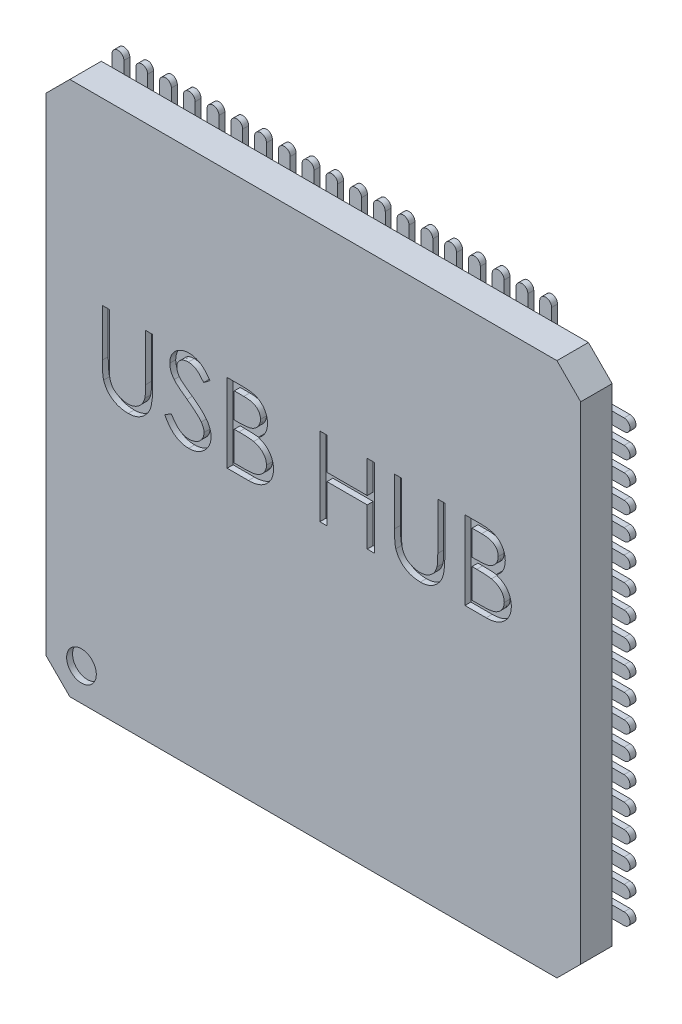
from build123d import *

# Parameters (mm, degrees)
ESQUISSE1_W                         = 9
ESQUISSE1_H                         = 9
BOSS_EXTRU_1_DEPTH                  = 0.53
DIAM_TRE_DU_PER_AGE_0_5_0_5_1_D     = 0.5
DIAM_TRE_DU_PER_AGE_0_5_0_5_1_DEPTH = 0.1
CHANFREIN1_SIZE                     = 0.4
ENL_V_MAT_EXTRU_1_DEPTH             = 0.1
ESQUISSE4_W                         = 6.1
ESQUISSE4_H                         = 6.1
BOSS_EXTRU_2_DEPTH                  = 0.1


with BuildPart() as part:
    # Esquisse1 → Boss.-Extru.1 (new body)
    with BuildSketch(Plane(origin=(0, 0, 6.629712515), x_dir=(-1, 0, 0), z_dir=(0, 0, -1))):
        with Locations((-7.398512621, 3.060383304)):
            Rectangle(ESQUISSE1_W, ESQUISSE1_H)
    extrude(amount=-BOSS_EXTRU_1_DEPTH)

    # Diamètre du perçage Ø0.5 (0.5)1
    with Locations(Plane.XY.offset(7.159712515)):
        with Locations((3.49470675, -0.891699119)):
            Hole(DIAM_TRE_DU_PER_AGE_0_5_0_5_1_D / 2, depth=DIAM_TRE_DU_PER_AGE_0_5_0_5_1_DEPTH)

    # Chanfrein1
    chanfrein1_edges = [part.edges().sort_by_distance(p)[0] for p in [
        (2.898512621, 7.560383304, 6.894712515),
        (2.898512621, -1.439616696, 6.894712515),
        (11.898512621, -1.439616696, 6.894712515),
        (11.898512621, 7.560383304, 6.894712515),
    ]]
    chamfer(chanfrein1_edges, length=CHANFREIN1_SIZE)

    # Esquisse5 → Enlèv. mat.-Extru.1 (cut)
    # profile 1 of 6: a face of its own
    with BuildSketch(Plane.XY.offset(7.159712515)):
        with BuildLine():
            Line((3.84456863, 4.539442904), (3.96329192, 4.539442904))
            Line((3.96329192, 4.539442904), (3.96329192, 3.746805935))
            add(Edge.make_bspline(
                [(3.96329192, 3.746805935), (3.963274252, 3.735587324), (3.963240724, 3.714298075), (3.96346468, 3.683996367), (3.964091882, 3.657057074), (3.964487305, 3.633376356), (3.965366982, 3.613062877), (3.966084399, 3.596006584), (3.967006871, 3.58228824), (3.968115519, 3.574282354), (3.968592067, 3.570841058)],
                knots=[0, 0, 0, 0, 1.528628734, 2.90083645, 4.128790002, 5.200304208, 6.127813768, 6.898992206, 7.526736466, 8, 8, 8, 8], degree=3))
            add(Edge.make_bspline(
                [(3.968592067, 3.570841058), (3.970549023, 3.558425764), (3.974352668, 3.534294732), (3.984046388, 3.499933566), (3.997584551, 3.468965426), (4.013627011, 3.440423955), (4.034768206, 3.415103572), (4.060093947, 3.391778037), (4.090777211, 3.37137798), (4.124893571, 3.352724548), (4.161665074, 3.337732091), (4.199240166, 3.326395314), (4.23705403, 3.319486325), (4.262369426, 3.318686323), (4.274940558, 3.318289058)],
                knots=[0, 0, 0, 0, 1.035780045, 2.013197591, 2.933192213, 3.817615948, 4.702609284, 5.640816605, 6.646850145, 7.73207398, 8.84249596, 9.914020372, 10.964143139, 12, 12, 12, 12], degree=3))
            add(Edge.make_bspline(
                [(4.274940558, 3.318289058), (4.285733192, 3.318694948), (4.307256125, 3.319504383), (4.339235341, 3.324516889), (4.37038062, 3.333550733), (4.400845758, 3.345207428), (4.429402232, 3.360609047), (4.456065973, 3.378400704), (4.479864841, 3.3992691), (4.501582596, 3.422363576), (4.520494611, 3.448421179), (4.53688787, 3.476874523), (4.550315825, 3.508151805), (4.55694686, 3.530132792), (4.560353469, 3.541425243)],
                knots=[0, 0, 0, 0, 0.994687771, 1.983630487, 2.973142513, 3.978332533, 4.983357753, 5.956394766, 6.925816176, 7.893390482, 8.871859704, 9.88551698, 10.913711441, 12, 12, 12, 12], degree=3))
            add(Edge.make_bspline(
                [(4.560353469, 3.541425243), (4.561487445, 3.54609271), (4.5640144, 3.556493708), (4.566375634, 3.574077648), (4.568834946, 3.59482452), (4.570541346, 3.61888339), (4.572204903, 3.646173639), (4.573200141, 3.676837433), (4.573660151, 3.710763427), (4.573797235, 3.734438782), (4.573868844, 3.746805935)],
                knots=[0, 0, 0, 0, 0.558680831, 1.244966039, 2.062412453, 2.990489873, 4.051219941, 5.244515665, 6.560634259, 8, 8, 8, 8], degree=3))
            Line((4.573868844, 3.746805935), (4.573868844, 4.539442904))
            Line((4.573868844, 4.539442904), (4.692592134, 4.539442904))
            Line((4.692592134, 4.539442904), (4.692592134, 3.740445759))
            add(Edge.make_bspline(
                [(4.692592134, 3.740445759), (4.692496083, 3.726045479), (4.692308632, 3.697942457), (4.690683117, 3.656761437), (4.688091334, 3.617696471), (4.684429468, 3.580742307), (4.679577386, 3.546031181), (4.674181693, 3.513258843), (4.667310262, 3.48266054), (4.659284542, 3.453997691), (4.650109719, 3.426713286), (4.638225713, 3.400818661), (4.624836096, 3.375526611), (4.608955557, 3.351219677), (4.591110779, 3.327790236), (4.570907316, 3.305380377), (4.549013362, 3.283631987), (4.525064957, 3.263102942), (4.499456872, 3.244276448), (4.472265281, 3.227721933), (4.443699061, 3.213727887), (4.413832469, 3.202208713), (4.382652758, 3.19354754), (4.350159143, 3.187093538), (4.316277662, 3.183426301), (4.293234474, 3.182881285), (4.281565742, 3.182605298)],
                knots=[0, 0, 0, 0, 1.316592851, 2.569410997, 3.76748051, 4.895814652, 5.963796859, 6.97159953, 7.931736103, 8.829262218, 9.692595152, 10.560224239, 11.431080259, 12.30701507, 13.211635791, 14.121146779, 15.063487852, 16.031507147, 17.00238618, 17.966455255, 18.938106653, 19.907068911, 20.888905087, 21.893141452, 22.933117798, 24, 24, 24, 24], degree=3))
            add(Edge.make_bspline(
                [(4.281565742, 3.182605298), (4.268839623, 3.18290192), (4.243871023, 3.183483893), (4.207079551, 3.186818682), (4.171809006, 3.193100039), (4.137686874, 3.201097994), (4.10517771, 3.212128752), (4.073845962, 3.225017032), (4.044228246, 3.240845639), (4.015844075, 3.258456832), (3.98945198, 3.278272097), (3.965224688, 3.299869722), (3.943122201, 3.322903734), (3.923517069, 3.347623515), (3.906084472, 3.373836809), (3.891067398, 3.401617772), (3.878173404, 3.430955647), (3.87151854, 3.451348672), (3.868154284, 3.461658032)],
                knots=[0, 0, 0, 0, 1.13879206, 2.234305948, 3.301075583, 4.341971843, 5.366689343, 6.369221514, 7.369726634, 8.367512178, 9.355451585, 10.318319045, 11.268648973, 12.207971039, 13.137398894, 14.081662264, 15.030215811, 16, 16, 16, 16], degree=3))
            add(Edge.make_bspline(
                [(3.868154284, 3.461658032), (3.866197441, 3.468700701), (3.861953006, 3.483976408), (3.85740773, 3.509257909), (3.853586738, 3.538367714), (3.849993863, 3.571307817), (3.84787381, 3.608103748), (3.846015136, 3.648739559), (3.844555536, 3.693264384), (3.844564143, 3.724279037), (3.84456863, 3.740445759)],
                knots=[0, 0, 0, 0, 0.625038921, 1.35572334, 2.194682327, 3.136881307, 4.189498639, 5.346923369, 6.617055217, 8, 8, 8, 8], degree=3))
            Line((3.84456863, 3.740445759), (3.84456863, 4.539442904))
        make_face()
    # profile 2 of 6: a face of its own
    with BuildSketch(Plane.XY.offset(7.159712515)):
        with BuildLine():
            Line((4.896117775, 3.471728311), (5.007950875, 3.538775169))
            add(Edge.make_bspline(
                [(5.007950875, 3.538775169), (5.018352113, 3.521363929), (5.038280485, 3.488004663), (5.071524004, 3.442927964), (5.105970075, 3.404615482), (5.141873781, 3.373290097), (5.17901597, 3.348627572), (5.21763911, 3.331164228), (5.257613044, 3.320272475), (5.284817435, 3.318949526), (5.298398925, 3.318289058)],
                knots=[0, 0, 0, 0, 1.272034388, 2.437168799, 3.508375237, 4.49857839, 5.41946034, 6.295179144, 7.148887113, 8, 8, 8, 8], degree=3))
            add(Edge.make_bspline(
                [(5.298398925, 3.318289058), (5.309997828, 3.318612104), (5.332992679, 3.319252543), (5.366845075, 3.325406299), (5.399722125, 3.334860288), (5.430946223, 3.348399747), (5.46008653, 3.364780663), (5.485640251, 3.384566272), (5.50773149, 3.406718022), (5.525802197, 3.431431109), (5.539666377, 3.458009317), (5.550322308, 3.485290108), (5.556235773, 3.513702037), (5.55712657, 3.532831587), (5.557576108, 3.542485272)],
                knots=[0, 0, 0, 0, 1.095163259, 2.171163733, 3.241058638, 4.321873601, 5.38011039, 6.391990106, 7.366004449, 8.327778327, 9.272591725, 10.192022065, 11.087607919, 12, 12, 12, 12], degree=3))
            add(Edge.make_bspline(
                [(5.557576108, 3.542485272), (5.557018854, 3.55349982), (5.555886037, 3.575890785), (5.546311341, 3.608925773), (5.531249275, 3.641617905), (5.517353871, 3.661840109), (5.510139794, 3.672338871)],
                knots=[0, 0, 0, 0, 0.938893495, 1.908633276, 2.914225137, 4, 4, 4, 4], degree=3))
            add(Edge.make_bspline(
                [(5.510139794, 3.672338871), (5.504216675, 3.679916093), (5.491781827, 3.695823523), (5.470404434, 3.719501931), (5.445319623, 3.743926154), (5.417385839, 3.770028834), (5.385585534, 3.796595947), (5.350914718, 3.824894374), (5.3124882, 3.853847946), (5.285538688, 3.873265553), (5.271633183, 3.883284718)],
                knots=[0, 0, 0, 0, 0.722233717, 1.516239348, 2.393582979, 3.351407094, 4.387010283, 5.505090956, 6.712668013, 8, 8, 8, 8], degree=3))
            add(Edge.make_bspline(
                [(5.271633183, 3.883284718), (5.257714589, 3.8931985), (5.231103298, 3.912152895), (5.193888298, 3.940283503), (5.160609587, 3.966002465), (5.131415078, 3.989551898), (5.106317611, 4.010934996), (5.085119417, 4.029946419), (5.068360498, 4.047100325), (5.059041276, 4.058228451), (5.054857175, 4.063224705)],
                knots=[0, 0, 0, 0, 1.452282411, 2.77665338, 3.964542531, 5.026858415, 5.96415736, 6.766646006, 7.446254459, 8, 8, 8, 8], degree=3))
            add(Edge.make_bspline(
                [(5.054857175, 4.063224705), (5.049008921, 4.071011407), (5.037507545, 4.086325), (5.022325752, 4.110260289), (5.009421961, 4.13476194), (4.999306437, 4.159895793), (4.990788282, 4.185308995), (4.985058946, 4.211333127), (4.981471423, 4.237851414), (4.981104036, 4.255696993), (4.980920126, 4.264630288)],
                knots=[0, 0, 0, 0, 1.068054152, 2.10047183, 3.106115577, 4.101338837, 5.06977816, 6.043150881, 7.020423561, 8, 8, 8, 8], degree=3))
            add(Edge.make_bspline(
                [(4.980920126, 4.264630288), (4.981413463, 4.278626661), (4.982389595, 4.306320244), (4.99064479, 4.34677535), (5.003674723, 4.385399383), (5.021929041, 4.421809955), (5.045460838, 4.455059001), (5.072692501, 4.48552898), (5.1051272, 4.511143891), (5.140714649, 4.533524639), (5.179667504, 4.551042295), (5.220485495, 4.564256713), (5.263233495, 4.571744141), (5.292187656, 4.572818639), (5.30687916, 4.573363845)],
                knots=[0, 0, 0, 0, 1.005424448, 1.989358655, 2.955360095, 3.929531133, 4.905563448, 5.876582895, 6.856512386, 7.866279853, 8.892233794, 9.918561126, 10.94386622, 12, 12, 12, 12], degree=3))
            add(Edge.make_bspline(
                [(5.30687916, 4.573363845), (5.322468448, 4.572826154), (5.353470566, 4.571756859), (5.399073097, 4.562459578), (5.442979082, 4.547075693), (5.478298411, 4.52961748), (5.505940854, 4.512180903), (5.527021619, 4.49629841), (5.54838387, 4.478013771), (5.57019992, 4.457278282), (5.59210011, 4.433901683), (5.614409569, 4.408044071), (5.637180469, 4.379863468), (5.651829261, 4.359745874), (5.659338929, 4.349432638)],
                knots=[0, 0, 0, 0, 1.286793592, 2.559021753, 3.825965368, 5.121522368, 5.803751409, 6.523245864, 7.299691795, 8.125521123, 9.008227632, 9.944561021, 10.946284179, 12, 12, 12, 12], degree=3))
            Line((5.659338929, 4.349432638), (5.552010954, 4.268075383))
            add(Edge.make_bspline(
                [(5.552010954, 4.268075383), (5.5455302, 4.276424382), (5.533049783, 4.292502602), (5.51410203, 4.315019141), (5.496243166, 4.335587275), (5.478648223, 4.353452368), (5.462246464, 4.369592758), (5.446327225, 4.383411475), (5.431119598, 4.395043917), (5.411949813, 4.407458001), (5.387866033, 4.419763584), (5.357633782, 4.43017648), (5.326040161, 4.436433899), (5.304522115, 4.437261247), (5.293628793, 4.437680084)],
                knots=[0, 0, 0, 0, 1.181633172, 2.275549214, 3.290209073, 4.226197932, 5.078386478, 5.862611352, 6.581680152, 7.217281963, 8.414376989, 9.595101626, 10.782541182, 12, 12, 12, 12], degree=3))
            add(Edge.make_bspline(
                [(5.293628793, 4.437680084), (5.279962488, 4.43722209), (5.253608307, 4.436338892), (5.216192355, 4.426692946), (5.182516972, 4.411505159), (5.153581925, 4.390219438), (5.129490866, 4.365000492), (5.1120641, 4.335979912), (5.101575199, 4.303934183), (5.100295265, 4.281580045), (5.099643416, 4.270195442)],
                knots=[0, 0, 0, 0, 1.14458467, 2.207223713, 3.21896685, 4.227309161, 5.202851033, 6.127160689, 7.046193047, 8, 8, 8, 8], degree=3))
            add(Edge.make_bspline(
                [(5.099643416, 4.270195442), (5.099792009, 4.263107829), (5.100089437, 4.248921015), (5.104237649, 4.227961698), (5.10956686, 4.207055328), (5.118011842, 4.1862959), (5.129670633, 4.165320353), (5.144980625, 4.143767494), (5.164262442, 4.121447354), (5.179032622, 4.106930281), (5.186830833, 4.099265704)],
                knots=[0, 0, 0, 0, 0.858281714, 1.717966888, 2.583508476, 3.4729293, 4.427298488, 5.488583878, 6.674047936, 8, 8, 8, 8], degree=3))
            add(Edge.make_bspline(
                [(5.186830833, 4.099265704), (5.189726649, 4.096681471), (5.196606446, 4.090541925), (5.209183953, 4.080490676), (5.225793285, 4.068092009), (5.246000724, 4.05275097), (5.270178864, 4.034955298), (5.298330363, 4.014932534), (5.330141418, 3.992032673), (5.352714881, 3.976022532), (5.364650761, 3.967557054)],
                knots=[0, 0, 0, 0, 0.420754252, 0.999615792, 1.744751191, 2.668019286, 3.750313428, 4.999500688, 6.413464383, 8, 8, 8, 8], degree=3))
            add(Edge.make_bspline(
                [(5.364650761, 3.967557054), (5.379008532, 3.957109278), (5.406810365, 3.936878608), (5.446368439, 3.906483396), (5.482236039, 3.876756412), (5.514539095, 3.847887495), (5.543596736, 3.820095626), (5.569086589, 3.793046448), (5.591268378, 3.766933747), (5.615148619, 3.733455422), (5.639549937, 3.692338762), (5.660505507, 3.641962761), (5.67371893, 3.591390938), (5.675446854, 3.557400734), (5.676299399, 3.540630221)],
                knots=[0, 0, 0, 0, 1.163667725, 2.253281268, 3.268753668, 4.215851969, 5.092017293, 5.902905408, 6.650798638, 7.335211899, 8.59617414, 9.77448103, 10.901945474, 12, 12, 12, 12], degree=3))
            add(Edge.make_bspline(
                [(5.676299399, 3.540630221), (5.676051016, 3.528769946), (5.675559075, 3.505279715), (5.669904206, 3.470787468), (5.661619094, 3.43728711), (5.649131806, 3.405192731), (5.633890612, 3.373917181), (5.614550989, 3.344280861), (5.592134096, 3.315627848), (5.566418953, 3.288722183), (5.538280174, 3.264022876), (5.508539611, 3.242051475), (5.477148586, 3.223731603), (5.444277388, 3.208782326), (5.409918469, 3.197090193), (5.374083385, 3.188618662), (5.336713063, 3.183419331), (5.311312881, 3.182879671), (5.298398925, 3.182605298)],
                knots=[0, 0, 0, 0, 0.983748083, 1.948392443, 2.894712957, 3.844097841, 4.80183111, 5.778335162, 6.776009319, 7.81870978, 8.863265674, 9.881300176, 10.883814829, 11.87499822, 12.874611388, 13.892143829, 14.928324115, 16, 16, 16, 16], degree=3))
            add(Edge.make_bspline(
                [(5.298398925, 3.182605298), (5.288406995, 3.182798512), (5.268548972, 3.183182508), (5.239176638, 3.186577218), (5.210397687, 3.1913802), (5.182573241, 3.199005519), (5.155344814, 3.208257233), (5.12883083, 3.219648805), (5.103018437, 3.233300247), (5.077762982, 3.248908784), (5.053128696, 3.267073467), (5.029346635, 3.288230116), (5.005636496, 3.311795232), (4.982698105, 3.338408749), (4.960067482, 3.367640703), (4.938190822, 3.39976459), (4.916615292, 3.434605435), (4.903077897, 3.459122893), (4.896117775, 3.471728311)],
                knots=[0, 0, 0, 0, 0.915332311, 1.819136955, 2.706846663, 3.586547465, 4.459518054, 5.340707479, 6.227863349, 7.133153174, 8.059268498, 9.028702269, 10.047606654, 11.120612155, 12.245963614, 13.433783089, 14.680604001, 16, 16, 16, 16], degree=3))
        make_face()
    # profile 3 of 6: a face of its own
    with BuildSketch(Plane.XY.offset(7.159712515)):
        with BuildLine():
            Line((5.94766692, 4.539442904), (6.205784075, 4.539442904))
            add(Edge.make_bspline(
                [(6.205784075, 4.539442904), (6.218419243, 4.539376475), (6.242909345, 4.539247718), (6.278522051, 4.53725082), (6.311878, 4.534528005), (6.342986866, 4.530207702), (6.371834275, 4.524994738), (6.398507162, 4.51868185), (6.422920709, 4.511112266), (6.452067487, 4.49907513), (6.485299404, 4.481188099), (6.521282129, 4.454756767), (6.552050994, 4.422427532), (6.57857975, 4.385959386), (6.599671245, 4.345842591), (6.614929878, 4.303033314), (6.624590147, 4.258083727), (6.625583632, 4.22722455), (6.626085724, 4.211628819)],
                knots=[0, 0, 0, 0, 1.001505555, 1.941167018, 2.826882275, 3.653841531, 4.429895133, 5.150066043, 5.825578002, 6.45369114, 7.647487171, 8.808567382, 9.977351308, 11.170798116, 12.373658725, 13.556498008, 14.765093433, 16, 16, 16, 16], degree=3))
            add(Edge.make_bspline(
                [(6.626085724, 4.211628819), (6.625672513, 4.197019073), (6.624860516, 4.168309545), (6.617095842, 4.126318616), (6.604939875, 4.086347174), (6.588042355, 4.048541093), (6.566081184, 4.013754579), (6.540054379, 3.981707011), (6.508653326, 3.953755272), (6.485126863, 3.938128639), (6.473176486, 3.930191018)],
                knots=[0, 0, 0, 0, 1.044552857, 2.05264487, 3.044412934, 4.028983338, 5.005914585, 5.980388656, 6.974128949, 8, 8, 8, 8], degree=3))
            add(Edge.make_bspline(
                [(6.473176486, 3.930191018), (6.488204981, 3.924421212), (6.516958214, 3.913382143), (6.556527035, 3.893865168), (6.590618538, 3.872637227), (6.619494841, 3.849455248), (6.644190919, 3.824467691), (6.665755572, 3.797308169), (6.684155972, 3.767622389), (6.699922464, 3.735719862), (6.712225119, 3.701926346), (6.721438631, 3.66655882), (6.726717994, 3.629744107), (6.727469275, 3.604689812), (6.727848544, 3.592041646)],
                knots=[0, 0, 0, 0, 1.27268992, 2.434971085, 3.483601985, 4.442670788, 5.356604649, 6.2567628, 7.179492994, 8.113709626, 9.066344395, 10.018646069, 10.999752585, 12, 12, 12, 12], degree=3))
            add(Edge.make_bspline(
                [(6.727848544, 3.592041646), (6.72747932, 3.579127382), (6.72675286, 3.553718205), (6.721393168, 3.516391116), (6.712318298, 3.480719633), (6.699818192, 3.446473031), (6.683503865, 3.413717563), (6.663649545, 3.382416121), (6.639976305, 3.352883205), (6.613494209, 3.324790645), (6.583535005, 3.299531332), (6.551212085, 3.277035812), (6.516118387, 3.258535366), (6.478830282, 3.242994489), (6.438929484, 3.231123316), (6.396595165, 3.222818206), (6.351863837, 3.217222254), (6.321168485, 3.21676218), (6.305426836, 3.216526238)],
                knots=[0, 0, 0, 0, 0.978564426, 1.925352924, 2.850884081, 3.763762016, 4.682927383, 5.618979971, 6.567305752, 7.547517671, 8.540179244, 9.531824382, 10.526200242, 11.540722885, 12.589160233, 13.674978461, 14.80764778, 16, 16, 16, 16], degree=3))
            Line((6.305426836, 3.216526238), (5.94766692, 3.216526238))
            Line((5.94766692, 3.216526238), (5.94766692, 4.539442904))
        make_face()
        with BuildLine():
            Line((6.066390211, 4.403759144), (6.066390211, 3.979747392))
            Line((6.066390211, 3.979747392), (6.146157422, 3.979747392))
            add(Edge.make_bspline(
                [(6.146157422, 3.979747392), (6.157817532, 3.979898553), (6.180347241, 3.980190628), (6.212974107, 3.981027284), (6.243259456, 3.983369997), (6.271151012, 3.985712037), (6.296604852, 3.989519991), (6.319564586, 3.994052728), (6.340390543, 3.998846564), (6.364406979, 4.006999317), (6.391648837, 4.019048319), (6.420689921, 4.037747495), (6.446291938, 4.060019497), (6.467911113, 4.085718462), (6.485604734, 4.114016098), (6.497894145, 4.144460901), (6.506227493, 4.176294106), (6.506980245, 4.198148029), (6.507362433, 4.209243752)],
                knots=[0, 0, 0, 0, 1.156816544, 2.235205308, 3.236616184, 4.169592532, 5.011045266, 5.787822928, 6.49130361, 7.128639758, 8.301311294, 9.436451833, 10.541879658, 11.654887649, 12.756523258, 13.837046038, 14.901820046, 16, 16, 16, 16], degree=3))
            add(Edge.make_bspline(
                [(6.507362433, 4.209243752), (6.50716355, 4.216586232), (6.506773418, 4.230989306), (6.503578271, 4.251985639), (6.49814767, 4.271732534), (6.491172386, 4.290500605), (6.481424876, 4.307703001), (6.46994821, 4.323934507), (6.456081892, 4.338642361), (6.440298622, 4.352389165), (6.422152506, 4.364576829), (6.401654369, 4.375251165), (6.378526884, 4.383846637), (6.353159822, 4.391374469), (6.325162715, 4.396661711), (6.294858643, 4.401066414), (6.261999389, 4.403308849), (6.239265972, 4.403605698), (6.227514677, 4.403759144)],
                knots=[0, 0, 0, 0, 0.91205012, 1.789085906, 2.630437955, 3.453916878, 4.269457761, 5.079663411, 5.91843418, 6.774407191, 7.675494373, 8.627863946, 9.638891023, 10.736472738, 11.911756761, 13.175263542, 14.539845004, 16, 16, 16, 16], degree=3))
            Line((6.227514677, 4.403759144), (6.066390211, 4.403759144))
        make_face(mode=Mode.SUBTRACT)
        with BuildLine():
            Line((6.066390211, 3.844063631), (6.066390211, 3.352209998))
            Line((6.066390211, 3.352209998), (6.235464897, 3.352209998))
            add(Edge.make_bspline(
                [(6.235464897, 3.352209998), (6.247567289, 3.352355046), (6.270893053, 3.352634606), (6.304571197, 3.35354725), (6.335785644, 3.355623199), (6.364393957, 3.358891124), (6.390705051, 3.362435955), (6.41440329, 3.367202719), (6.435680776, 3.372664082), (6.460352911, 3.381105867), (6.488135487, 3.394220307), (6.518075304, 3.413993839), (6.544694738, 3.437550566), (6.567299702, 3.464814334), (6.585825445, 3.494459508), (6.599302358, 3.525886471), (6.607614378, 3.558575941), (6.608620615, 3.580863954), (6.609125254, 3.592041646)],
                knots=[0, 0, 0, 0, 1.160039823, 2.235823828, 3.228722157, 4.157150951, 4.99529583, 5.772374946, 6.472645482, 7.099169577, 8.269452708, 9.405989375, 10.527446681, 11.663510218, 12.788923519, 13.866172445, 14.929861265, 16, 16, 16, 16], degree=3))
            add(Edge.make_bspline(
                [(6.609125254, 3.592041646), (6.609020893, 3.599031688), (6.608813855, 3.612899023), (6.605691539, 3.633277919), (6.601150582, 3.653018056), (6.59528007, 3.672173035), (6.58673045, 3.690396543), (6.576749405, 3.708048999), (6.565046732, 3.725153736), (6.546811586, 3.746778606), (6.520288246, 3.771693667), (6.482601459, 3.796087307), (6.43974943, 3.815760139), (6.408669395, 3.824113214), (6.392614253, 3.828428198)],
                knots=[0, 0, 0, 0, 0.723448775, 1.435228256, 2.130040452, 2.821711965, 3.505591119, 4.210454504, 4.921174351, 5.648778258, 7.137944449, 8.670945889, 10.280296675, 12, 12, 12, 12], degree=3))
            add(Edge.make_bspline(
                [(6.392614253, 3.828428198), (6.38617766, 3.829734137), (6.372221799, 3.832565683), (6.349464767, 3.835554607), (6.323484245, 3.838217472), (6.294220241, 3.840187165), (6.26163573, 3.84222315), (6.225661121, 3.843014943), (6.186443326, 3.843959604), (6.159231924, 3.844028068), (6.145097393, 3.844063631)],
                knots=[0, 0, 0, 0, 0.634451884, 1.375622551, 2.216452059, 3.157844607, 4.20941857, 5.370758133, 6.634282058, 8, 8, 8, 8], degree=3))
            Line((6.145097393, 3.844063631), (6.066390211, 3.844063631))
        make_face(mode=Mode.SUBTRACT)
    # profile 4 of 6: a face of its own
    with BuildSketch(Plane.XY.offset(7.159712515)):
        Polygon((7.508030168, 4.539442904), (7.626753459, 4.539442904), (7.626753459, 3.996707862), (8.305172262, 3.996707862), (8.305172262, 4.539442904), (8.423895553, 4.539442904), (8.423895553, 3.216526238), (8.305172262, 3.216526238), (8.305172262, 3.861024101), (7.626753459, 3.861024101), (7.626753459, 3.216526238), (7.508030168, 3.216526238), align=None)
    # profile 5 of 6: a face of its own
    with BuildSketch(Plane.XY.offset(7.159712515)):
        with BuildLine():
            Line((8.763104955, 4.539442904), (8.881828245, 4.539442904))
            Line((8.881828245, 4.539442904), (8.881828245, 3.746805935))
            add(Edge.make_bspline(
                [(8.881828245, 3.746805935), (8.881810577, 3.735587324), (8.881777049, 3.714298075), (8.882001005, 3.683996367), (8.882628207, 3.657057074), (8.88302363, 3.633376356), (8.883903307, 3.613062877), (8.884620723, 3.596006584), (8.885543196, 3.58228824), (8.886651844, 3.574282354), (8.887128392, 3.570841058)],
                knots=[0, 0, 0, 0, 1.528628734, 2.90083645, 4.128790002, 5.200304208, 6.127813768, 6.898992206, 7.526736466, 8, 8, 8, 8], degree=3))
            add(Edge.make_bspline(
                [(8.887128392, 3.570841058), (8.889085348, 3.558425764), (8.892888993, 3.534294732), (8.902582713, 3.499933566), (8.916120876, 3.468965426), (8.932163335, 3.440423955), (8.953304531, 3.415103572), (8.978630272, 3.391778037), (9.009313536, 3.37137798), (9.043429895, 3.352724548), (9.080201399, 3.337732091), (9.117776491, 3.326395314), (9.155590355, 3.319486325), (9.180905751, 3.318686323), (9.193476883, 3.318289058)],
                knots=[0, 0, 0, 0, 1.035780045, 2.013197591, 2.933192213, 3.817615948, 4.702609284, 5.640816605, 6.646850145, 7.73207398, 8.84249596, 9.914020372, 10.964143139, 12, 12, 12, 12], degree=3))
            add(Edge.make_bspline(
                [(9.193476883, 3.318289058), (9.204269517, 3.318694948), (9.22579245, 3.319504383), (9.257771666, 3.324516889), (9.288916945, 3.333550733), (9.319382083, 3.345207428), (9.347938556, 3.360609047), (9.374602298, 3.378400704), (9.398401166, 3.3992691), (9.420118921, 3.422363576), (9.439030935, 3.448421179), (9.455424194, 3.476874523), (9.46885215, 3.508151805), (9.475483185, 3.530132792), (9.478889794, 3.541425243)],
                knots=[0, 0, 0, 0, 0.994687771, 1.983630487, 2.973142513, 3.978332533, 4.983357753, 5.956394766, 6.925816176, 7.893390482, 8.871859704, 9.88551698, 10.913711441, 12, 12, 12, 12], degree=3))
            add(Edge.make_bspline(
                [(9.478889794, 3.541425243), (9.48002377, 3.54609271), (9.482550725, 3.556493708), (9.484911959, 3.574077648), (9.487371271, 3.59482452), (9.489077671, 3.61888339), (9.490741227, 3.646173639), (9.491736466, 3.676837433), (9.492196476, 3.710763427), (9.49233356, 3.734438782), (9.492405168, 3.746805935)],
                knots=[0, 0, 0, 0, 0.558680831, 1.244966039, 2.062412453, 2.990489873, 4.051219941, 5.244515665, 6.560634259, 8, 8, 8, 8], degree=3))
            Line((9.492405168, 3.746805935), (9.492405168, 4.539442904))
            Line((9.492405168, 4.539442904), (9.611128459, 4.539442904))
            Line((9.611128459, 4.539442904), (9.611128459, 3.740445759))
            add(Edge.make_bspline(
                [(9.611128459, 3.740445759), (9.611032407, 3.726045479), (9.610844957, 3.697942457), (9.609219442, 3.656761437), (9.606627659, 3.617696471), (9.602965792, 3.580742307), (9.598113711, 3.546031181), (9.592718017, 3.513258843), (9.585846587, 3.48266054), (9.577820867, 3.453997691), (9.568646043, 3.426713286), (9.556762038, 3.400818661), (9.54337242, 3.375526611), (9.527491882, 3.351219677), (9.509647103, 3.327790236), (9.489443641, 3.305380377), (9.467549687, 3.283631987), (9.443601282, 3.263102942), (9.417993197, 3.244276448), (9.390801606, 3.227721933), (9.362235386, 3.213727887), (9.332368794, 3.202208713), (9.301189083, 3.19354754), (9.268695468, 3.187093538), (9.234813987, 3.183426301), (9.211770799, 3.182881285), (9.200102067, 3.182605298)],
                knots=[0, 0, 0, 0, 1.316592851, 2.569410997, 3.76748051, 4.895814652, 5.963796859, 6.97159953, 7.931736103, 8.829262218, 9.692595152, 10.560224239, 11.431080259, 12.30701507, 13.211635791, 14.121146779, 15.063487852, 16.031507147, 17.00238618, 17.966455255, 18.938106653, 19.907068911, 20.888905087, 21.893141452, 22.933117798, 24, 24, 24, 24], degree=3))
            add(Edge.make_bspline(
                [(9.200102067, 3.182605298), (9.187375948, 3.18290192), (9.162407347, 3.183483893), (9.125615875, 3.186818682), (9.090345331, 3.193100039), (9.056223199, 3.201097994), (9.023714035, 3.212128752), (8.992382286, 3.225017032), (8.962764571, 3.240845639), (8.9343804, 3.258456832), (8.907988305, 3.278272097), (8.883761012, 3.299869722), (8.861658526, 3.322903734), (8.842053393, 3.347623515), (8.824620797, 3.373836809), (8.809603722, 3.401617772), (8.796709728, 3.430955647), (8.790054865, 3.451348672), (8.786690608, 3.461658032)],
                knots=[0, 0, 0, 0, 1.13879206, 2.234305948, 3.301075583, 4.341971843, 5.366689343, 6.369221514, 7.369726634, 8.367512178, 9.355451585, 10.318319045, 11.268648973, 12.207971039, 13.137398894, 14.081662264, 15.030215811, 16, 16, 16, 16], degree=3))
            add(Edge.make_bspline(
                [(8.786690608, 3.461658032), (8.784733766, 3.468700701), (8.780489331, 3.483976408), (8.775944055, 3.509257909), (8.772123062, 3.538367714), (8.768530188, 3.571307817), (8.766410135, 3.608103748), (8.76455146, 3.648739559), (8.76309186, 3.693264384), (8.763100468, 3.724279037), (8.763104955, 3.740445759)],
                knots=[0, 0, 0, 0, 0.625038921, 1.35572334, 2.194682327, 3.136881307, 4.189498639, 5.346923369, 6.617055217, 8, 8, 8, 8], degree=3))
            Line((8.763104955, 3.740445759), (8.763104955, 4.539442904))
        make_face()
    # profile 6 of 6: a face of its own
    with BuildSketch(Plane.XY.offset(7.159712515)):
        with BuildLine():
            Line((9.950337861, 4.539442904), (10.208455015, 4.539442904))
            add(Edge.make_bspline(
                [(10.208455015, 4.539442904), (10.221090184, 4.539376475), (10.245580285, 4.539247718), (10.281192991, 4.53725082), (10.31454894, 4.534528005), (10.345657807, 4.530207702), (10.374505215, 4.524994738), (10.401178102, 4.51868185), (10.425591649, 4.511112266), (10.454738427, 4.49907513), (10.487970344, 4.481188099), (10.52395307, 4.454756767), (10.554721934, 4.422427532), (10.581250691, 4.385959386), (10.602342185, 4.345842591), (10.617600818, 4.303033314), (10.627261087, 4.258083727), (10.628254572, 4.22722455), (10.628756664, 4.211628819)],
                knots=[0, 0, 0, 0, 1.001505555, 1.941167018, 2.826882275, 3.653841531, 4.429895133, 5.150066043, 5.825578002, 6.45369114, 7.647487171, 8.808567382, 9.977351308, 11.170798116, 12.373658725, 13.556498008, 14.765093433, 16, 16, 16, 16], degree=3))
            add(Edge.make_bspline(
                [(10.628756664, 4.211628819), (10.628343453, 4.197019073), (10.627531456, 4.168309545), (10.619766782, 4.126318616), (10.607610815, 4.086347174), (10.590713295, 4.048541093), (10.568752124, 4.013754579), (10.542725319, 3.981707011), (10.511324266, 3.953755272), (10.487797803, 3.938128639), (10.475847426, 3.930191018)],
                knots=[0, 0, 0, 0, 1.044552857, 2.05264487, 3.044412934, 4.028983338, 5.005914585, 5.980388656, 6.974128949, 8, 8, 8, 8], degree=3))
            add(Edge.make_bspline(
                [(10.475847426, 3.930191018), (10.490875921, 3.924421212), (10.519629155, 3.913382143), (10.559197975, 3.893865168), (10.593289479, 3.872637227), (10.622165781, 3.849455248), (10.646861859, 3.824467691), (10.668426512, 3.797308169), (10.686826913, 3.767622389), (10.702593405, 3.735719862), (10.714896059, 3.701926346), (10.724109571, 3.66655882), (10.729388934, 3.629744107), (10.730140215, 3.604689812), (10.730519485, 3.592041646)],
                knots=[0, 0, 0, 0, 1.27268992, 2.434971085, 3.483601985, 4.442670788, 5.356604649, 6.2567628, 7.179492994, 8.113709626, 9.066344395, 10.018646069, 10.999752585, 12, 12, 12, 12], degree=3))
            add(Edge.make_bspline(
                [(10.730519485, 3.592041646), (10.73015026, 3.579127382), (10.7294238, 3.553718205), (10.724064109, 3.516391116), (10.714989238, 3.480719633), (10.702489132, 3.446473031), (10.686174805, 3.413717563), (10.666320485, 3.382416121), (10.642647245, 3.352883205), (10.616165149, 3.324790645), (10.586205945, 3.299531332), (10.553883026, 3.277035812), (10.518789327, 3.258535366), (10.481501222, 3.242994489), (10.441600424, 3.231123316), (10.399266106, 3.222818206), (10.354534777, 3.217222254), (10.323839425, 3.21676218), (10.308097776, 3.216526238)],
                knots=[0, 0, 0, 0, 0.978564426, 1.925352924, 2.850884081, 3.763762016, 4.682927383, 5.618979971, 6.567305752, 7.547517671, 8.540179244, 9.531824382, 10.526200242, 11.540722885, 12.589160233, 13.674978461, 14.80764778, 16, 16, 16, 16], degree=3))
            Line((10.308097776, 3.216526238), (9.950337861, 3.216526238))
            Line((9.950337861, 3.216526238), (9.950337861, 4.539442904))
        make_face()
        with BuildLine():
            Line((10.069061151, 4.403759144), (10.069061151, 3.979747392))
            Line((10.069061151, 3.979747392), (10.148828362, 3.979747392))
            add(Edge.make_bspline(
                [(10.148828362, 3.979747392), (10.160488472, 3.979898553), (10.183018181, 3.980190628), (10.215645047, 3.981027284), (10.245930396, 3.983369997), (10.273821952, 3.985712037), (10.299275792, 3.989519991), (10.322235526, 3.994052728), (10.343061484, 3.998846564), (10.367077919, 4.006999317), (10.394319777, 4.019048319), (10.423360861, 4.037747495), (10.448962878, 4.060019497), (10.470582053, 4.085718462), (10.488275675, 4.114016098), (10.500565085, 4.144460901), (10.508898433, 4.176294106), (10.509651185, 4.198148029), (10.510033373, 4.209243752)],
                knots=[0, 0, 0, 0, 1.156816544, 2.235205308, 3.236616184, 4.169592532, 5.011045266, 5.787822928, 6.49130361, 7.128639758, 8.301311294, 9.436451833, 10.541879658, 11.654887649, 12.756523258, 13.837046038, 14.901820046, 16, 16, 16, 16], degree=3))
            add(Edge.make_bspline(
                [(10.510033373, 4.209243752), (10.50983449, 4.216586232), (10.509444358, 4.230989306), (10.506249211, 4.251985639), (10.50081861, 4.271732534), (10.493843326, 4.290500605), (10.484095816, 4.307703001), (10.47261915, 4.323934507), (10.458752832, 4.338642361), (10.442969562, 4.352389165), (10.424823446, 4.364576829), (10.404325309, 4.375251165), (10.381197824, 4.383846637), (10.355830763, 4.391374469), (10.327833655, 4.396661711), (10.297529583, 4.401066414), (10.264670329, 4.403308849), (10.241936912, 4.403605698), (10.230185617, 4.403759144)],
                knots=[0, 0, 0, 0, 0.91205012, 1.789085906, 2.630437955, 3.453916878, 4.269457761, 5.079663411, 5.91843418, 6.774407191, 7.675494373, 8.627863946, 9.638891023, 10.736472738, 11.911756761, 13.175263542, 14.539845004, 16, 16, 16, 16], degree=3))
            Line((10.230185617, 4.403759144), (10.069061151, 4.403759144))
        make_face(mode=Mode.SUBTRACT)
        with BuildLine():
            Line((10.069061151, 3.844063631), (10.069061151, 3.352209998))
            Line((10.069061151, 3.352209998), (10.238135837, 3.352209998))
            add(Edge.make_bspline(
                [(10.238135837, 3.352209998), (10.250238229, 3.352355046), (10.273563993, 3.352634606), (10.307242137, 3.35354725), (10.338456584, 3.355623199), (10.367064897, 3.358891124), (10.393375991, 3.362435955), (10.41707423, 3.367202719), (10.438351717, 3.372664082), (10.463023851, 3.381105867), (10.490806427, 3.394220307), (10.520746245, 3.413993839), (10.547365678, 3.437550566), (10.569970642, 3.464814334), (10.588496385, 3.494459508), (10.601973298, 3.525886471), (10.610285318, 3.558575941), (10.611291555, 3.580863954), (10.611796194, 3.592041646)],
                knots=[0, 0, 0, 0, 1.160039823, 2.235823828, 3.228722157, 4.157150951, 4.99529583, 5.772374946, 6.472645482, 7.099169577, 8.269452708, 9.405989375, 10.527446681, 11.663510218, 12.788923519, 13.866172445, 14.929861265, 16, 16, 16, 16], degree=3))
            add(Edge.make_bspline(
                [(10.611796194, 3.592041646), (10.611691833, 3.599031688), (10.611484795, 3.612899023), (10.608362479, 3.633277919), (10.603821522, 3.653018056), (10.59795101, 3.672173035), (10.58940139, 3.690396543), (10.579420345, 3.708048999), (10.567717672, 3.725153736), (10.549482526, 3.746778606), (10.522959187, 3.771693667), (10.485272399, 3.796087307), (10.44242037, 3.815760139), (10.411340336, 3.824113214), (10.395285193, 3.828428198)],
                knots=[0, 0, 0, 0, 0.723448775, 1.435228256, 2.130040452, 2.821711965, 3.505591119, 4.210454504, 4.921174351, 5.648778258, 7.137944449, 8.670945889, 10.280296675, 12, 12, 12, 12], degree=3))
            add(Edge.make_bspline(
                [(10.395285193, 3.828428198), (10.3888486, 3.829734137), (10.374892739, 3.832565683), (10.352135708, 3.835554607), (10.326155186, 3.838217472), (10.296891181, 3.840187165), (10.26430667, 3.84222315), (10.228332061, 3.843014943), (10.189114266, 3.843959604), (10.161902864, 3.844028068), (10.147768333, 3.844063631)],
                knots=[0, 0, 0, 0, 0.634451884, 1.375622551, 2.216452059, 3.157844607, 4.20941857, 5.370758133, 6.634282058, 8, 8, 8, 8], degree=3))
            Line((10.147768333, 3.844063631), (10.069061151, 3.844063631))
        make_face(mode=Mode.SUBTRACT)
    extrude(amount=-ENL_V_MAT_EXTRU_1_DEPTH, mode=Mode.SUBTRACT)

    # Esquisse4 → Boss.-Extru.2 (add)
    with BuildSketch(Plane(origin=(0, 0, 6.629712515), x_dir=(-1, 0, 0), z_dir=(0, 0, -1))):
        with Locations((-7.398512621, 3.060383304)):
            Rectangle(ESQUISSE4_W, ESQUISSE4_H)
        with BuildLine():
            Line((-3.098512621, 6.760383304), (-2.698512621, 6.760383304))
            ThreePointArc((-2.698512621, 6.760383304), (-2.598512621, 6.660383304), (-2.698512621, 6.560383304))
            Line((-2.698512621, 6.560383304), (-3.098512621, 6.560383304))
            ThreePointArc((-3.098512621, 6.560383304), (-3.198512621, 6.660383304), (-3.098512621, 6.760383304))
        make_face()
        with BuildLine():
            Line((-3.098512621, 6.360383304), (-2.698512621, 6.360383304))
            ThreePointArc((-2.698512621, 6.360383304), (-2.598512621, 6.260383304), (-2.698512621, 6.160383304))
            Line((-2.698512621, 6.160383304), (-3.098512621, 6.160383304))
            ThreePointArc((-3.098512621, 6.160383304), (-3.198512621, 6.260383304), (-3.098512621, 6.360383304))
        make_face()
        with BuildLine():
            Line((-3.098512621, 5.960383304), (-2.698512621, 5.960383304))
            ThreePointArc((-2.698512621, 5.960383304), (-2.598512621, 5.860383304), (-2.698512621, 5.760383304))
            Line((-2.698512621, 5.760383304), (-3.098512621, 5.760383304))
            ThreePointArc((-3.098512621, 5.760383304), (-3.198512621, 5.860383304), (-3.098512621, 5.960383304))
        make_face()
        with BuildLine():
            Line((-3.098512621, 5.560383304), (-2.698512621, 5.560383304))
            ThreePointArc((-2.698512621, 5.560383304), (-2.598512621, 5.460383304), (-2.698512621, 5.360383304))
            Line((-2.698512621, 5.360383304), (-3.098512621, 5.360383304))
            ThreePointArc((-3.098512621, 5.360383304), (-3.198512621, 5.460383304), (-3.098512621, 5.560383304))
        make_face()
        with BuildLine():
            Line((-3.098512621, 5.160383304), (-2.698512621, 5.160383304))
            ThreePointArc((-2.698512621, 5.160383304), (-2.598512621, 5.060383304), (-2.698512621, 4.960383304))
            Line((-2.698512621, 4.960383304), (-3.098512621, 4.960383304))
            ThreePointArc((-3.098512621, 4.960383304), (-3.198512621, 5.060383304), (-3.098512621, 5.160383304))
        make_face()
        with BuildLine():
            Line((-3.098512621, 4.760383304), (-2.698512621, 4.760383304))
            ThreePointArc((-2.698512621, 4.760383304), (-2.598512621, 4.660383304), (-2.698512621, 4.560383304))
            Line((-2.698512621, 4.560383304), (-3.098512621, 4.560383304))
            ThreePointArc((-3.098512621, 4.560383304), (-3.198512621, 4.660383304), (-3.098512621, 4.760383304))
        make_face()
        with BuildLine():
            Line((-3.098512621, 4.360383304), (-2.698512621, 4.360383304))
            ThreePointArc((-2.698512621, 4.360383304), (-2.598512621, 4.260383304), (-2.698512621, 4.160383304))
            Line((-2.698512621, 4.160383304), (-3.098512621, 4.160383304))
            ThreePointArc((-3.098512621, 4.160383304), (-3.198512621, 4.260383304), (-3.098512621, 4.360383304))
        make_face()
        with BuildLine():
            Line((-3.098512621, 3.960383304), (-2.698512621, 3.960383304))
            ThreePointArc((-2.698512621, 3.960383304), (-2.598512621, 3.860383304), (-2.698512621, 3.760383304))
            Line((-2.698512621, 3.760383304), (-3.098512621, 3.760383304))
            ThreePointArc((-3.098512621, 3.760383304), (-3.198512621, 3.860383304), (-3.098512621, 3.960383304))
        make_face()
        with BuildLine():
            Line((-3.098512621, 3.560383304), (-2.698512621, 3.560383304))
            ThreePointArc((-2.698512621, 3.560383304), (-2.598512621, 3.460383304), (-2.698512621, 3.360383304))
            Line((-2.698512621, 3.360383304), (-3.098512621, 3.360383304))
            ThreePointArc((-3.098512621, 3.360383304), (-3.198512621, 3.460383304), (-3.098512621, 3.560383304))
        make_face()
        with BuildLine():
            Line((-3.098512621, 3.160383304), (-2.698512621, 3.160383304))
            ThreePointArc((-2.698512621, 3.160383304), (-2.598512621, 3.060383304), (-2.698512621, 2.960383304))
            Line((-2.698512621, 2.960383304), (-3.098512621, 2.960383304))
            ThreePointArc((-3.098512621, 2.960383304), (-3.198512621, 3.060383304), (-3.098512621, 3.160383304))
        make_face()
        with BuildLine():
            Line((-3.098512621, 2.760383304), (-2.698512621, 2.760383304))
            ThreePointArc((-2.698512621, 2.760383304), (-2.598512621, 2.660383304), (-2.698512621, 2.560383304))
            Line((-2.698512621, 2.560383304), (-3.098512621, 2.560383304))
            ThreePointArc((-3.098512621, 2.560383304), (-3.198512621, 2.660383304), (-3.098512621, 2.760383304))
        make_face()
        with BuildLine():
            Line((-3.098512621, 2.360383304), (-2.698512621, 2.360383304))
            ThreePointArc((-2.698512621, 2.360383304), (-2.598512621, 2.260383304), (-2.698512621, 2.160383304))
            Line((-2.698512621, 2.160383304), (-3.098512621, 2.160383304))
            ThreePointArc((-3.098512621, 2.160383304), (-3.198512621, 2.260383304), (-3.098512621, 2.360383304))
        make_face()
        with BuildLine():
            Line((-3.098512621, 1.960383304), (-2.698512621, 1.960383304))
            ThreePointArc((-2.698512621, 1.960383304), (-2.598512621, 1.860383304), (-2.698512621, 1.760383304))
            Line((-2.698512621, 1.760383304), (-3.098512621, 1.760383304))
            ThreePointArc((-3.098512621, 1.760383304), (-3.198512621, 1.860383304), (-3.098512621, 1.960383304))
        make_face()
        with BuildLine():
            Line((-3.098512621, 1.560383304), (-2.698512621, 1.560383304))
            ThreePointArc((-2.698512621, 1.560383304), (-2.598512621, 1.460383304), (-2.698512621, 1.360383304))
            Line((-2.698512621, 1.360383304), (-3.098512621, 1.360383304))
            ThreePointArc((-3.098512621, 1.360383304), (-3.198512621, 1.460383304), (-3.098512621, 1.560383304))
        make_face()
        with BuildLine():
            Line((-3.098512621, 1.160383304), (-2.698512621, 1.160383304))
            ThreePointArc((-2.698512621, 1.160383304), (-2.598512621, 1.060383304), (-2.698512621, 0.960383304))
            Line((-2.698512621, 0.960383304), (-3.098512621, 0.960383304))
            ThreePointArc((-3.098512621, 0.960383304), (-3.198512621, 1.060383304), (-3.098512621, 1.160383304))
        make_face()
        with BuildLine():
            Line((-3.098512621, 0.760383304), (-2.698512621, 0.760383304))
            ThreePointArc((-2.698512621, 0.760383304), (-2.598512621, 0.660383304), (-2.698512621, 0.560383304))
            Line((-2.698512621, 0.560383304), (-3.098512621, 0.560383304))
            ThreePointArc((-3.098512621, 0.560383304), (-3.198512621, 0.660383304), (-3.098512621, 0.760383304))
        make_face()
        with BuildLine():
            Line((-3.098512621, 0.360383304), (-2.698512621, 0.360383304))
            ThreePointArc((-2.698512621, 0.360383304), (-2.598512621, 0.260383304), (-2.698512621, 0.160383304))
            Line((-2.698512621, 0.160383304), (-3.098512621, 0.160383304))
            ThreePointArc((-3.098512621, 0.160383304), (-3.198512621, 0.260383304), (-3.098512621, 0.360383304))
        make_face()
        with BuildLine():
            Line((-3.098512621, -0.039616696), (-2.698512621, -0.039616696))
            ThreePointArc((-2.698512621, -0.039616696), (-2.598512621, -0.139616696), (-2.698512621, -0.239616696))
            Line((-2.698512621, -0.239616696), (-3.098512621, -0.239616696))
            ThreePointArc((-3.098512621, -0.239616696), (-3.198512621, -0.139616696), (-3.098512621, -0.039616696))
        make_face()
        with BuildLine():
            Line((-3.098512621, -0.439616696), (-2.698512621, -0.439616696))
            ThreePointArc((-2.698512621, -0.439616696), (-2.598512621, -0.539616696), (-2.698512621, -0.639616696))
            Line((-2.698512621, -0.639616696), (-3.098512621, -0.639616696))
            ThreePointArc((-3.098512621, -0.639616696), (-3.198512621, -0.539616696), (-3.098512621, -0.439616696))
        make_face()
        with BuildLine():
            Line((-3.478512621, -1.239616696), (-3.478512621, -1.639616696))
            ThreePointArc((-3.478512621, -1.639616696), (-3.578512621, -1.739616696), (-3.678512621, -1.639616696))
            Line((-3.678512621, -1.639616696), (-3.678512621, -1.239616696))
            ThreePointArc((-3.678512621, -1.239616696), (-3.578512621, -1.139616696), (-3.478512621, -1.239616696))
        make_face()
        with BuildLine():
            Line((-3.878512621, -1.239616696), (-3.878512621, -1.639616696))
            ThreePointArc((-3.878512621, -1.639616696), (-3.978512621, -1.739616696), (-4.078512621, -1.639616696))
            Line((-4.078512621, -1.639616696), (-4.078512621, -1.239616696))
            ThreePointArc((-4.078512621, -1.239616696), (-3.978512621, -1.139616696), (-3.878512621, -1.239616696))
        make_face()
        with BuildLine():
            Line((-4.278512621, -1.239616696), (-4.278512621, -1.639616696))
            ThreePointArc((-4.278512621, -1.639616696), (-4.378512621, -1.739616696), (-4.478512621, -1.639616696))
            Line((-4.478512621, -1.639616696), (-4.478512621, -1.239616696))
            ThreePointArc((-4.478512621, -1.239616696), (-4.378512621, -1.139616696), (-4.278512621, -1.239616696))
        make_face()
        with BuildLine():
            Line((-4.678512621, -1.239616696), (-4.678512621, -1.639616696))
            ThreePointArc((-4.678512621, -1.639616696), (-4.778512621, -1.739616696), (-4.878512621, -1.639616696))
            Line((-4.878512621, -1.639616696), (-4.878512621, -1.239616696))
            ThreePointArc((-4.878512621, -1.239616696), (-4.778512621, -1.139616696), (-4.678512621, -1.239616696))
        make_face()
        with BuildLine():
            Line((-5.078512621, -1.239616696), (-5.078512621, -1.639616696))
            ThreePointArc((-5.078512621, -1.639616696), (-5.178512621, -1.739616696), (-5.278512621, -1.639616696))
            Line((-5.278512621, -1.639616696), (-5.278512621, -1.239616696))
            ThreePointArc((-5.278512621, -1.239616696), (-5.178512621, -1.139616696), (-5.078512621, -1.239616696))
        make_face()
        with BuildLine():
            Line((-5.478512621, -1.239616696), (-5.478512621, -1.639616696))
            ThreePointArc((-5.478512621, -1.639616696), (-5.578512621, -1.739616696), (-5.678512621, -1.639616696))
            Line((-5.678512621, -1.639616696), (-5.678512621, -1.239616696))
            ThreePointArc((-5.678512621, -1.239616696), (-5.578512621, -1.139616696), (-5.478512621, -1.239616696))
        make_face()
        with BuildLine():
            Line((-5.878512621, -1.239616696), (-5.878512621, -1.639616696))
            ThreePointArc((-5.878512621, -1.639616696), (-5.978512621, -1.739616696), (-6.078512621, -1.639616696))
            Line((-6.078512621, -1.639616696), (-6.078512621, -1.239616696))
            ThreePointArc((-6.078512621, -1.239616696), (-5.978512621, -1.139616696), (-5.878512621, -1.239616696))
        make_face()
        with BuildLine():
            Line((-6.278512621, -1.239616696), (-6.278512621, -1.639616696))
            ThreePointArc((-6.278512621, -1.639616696), (-6.378512621, -1.739616696), (-6.478512621, -1.639616696))
            Line((-6.478512621, -1.639616696), (-6.478512621, -1.239616696))
            ThreePointArc((-6.478512621, -1.239616696), (-6.378512621, -1.139616696), (-6.278512621, -1.239616696))
        make_face()
        with BuildLine():
            Line((-6.678512621, -1.239616696), (-6.678512621, -1.639616696))
            ThreePointArc((-6.678512621, -1.639616696), (-6.778512621, -1.739616696), (-6.878512621, -1.639616696))
            Line((-6.878512621, -1.639616696), (-6.878512621, -1.239616696))
            ThreePointArc((-6.878512621, -1.239616696), (-6.778512621, -1.139616696), (-6.678512621, -1.239616696))
        make_face()
        with BuildLine():
            Line((-7.078512621, -1.239616696), (-7.078512621, -1.639616696))
            ThreePointArc((-7.078512621, -1.639616696), (-7.178512621, -1.739616696), (-7.278512621, -1.639616696))
            Line((-7.278512621, -1.639616696), (-7.278512621, -1.239616696))
            ThreePointArc((-7.278512621, -1.239616696), (-7.178512621, -1.139616696), (-7.078512621, -1.239616696))
        make_face()
        with BuildLine():
            Line((-7.478512621, -1.239616696), (-7.478512621, -1.639616696))
            ThreePointArc((-7.478512621, -1.639616696), (-7.578512621, -1.739616696), (-7.678512621, -1.639616696))
            Line((-7.678512621, -1.639616696), (-7.678512621, -1.239616696))
            ThreePointArc((-7.678512621, -1.239616696), (-7.578512621, -1.139616696), (-7.478512621, -1.239616696))
        make_face()
        with BuildLine():
            Line((-7.878512621, -1.239616696), (-7.878512621, -1.639616696))
            ThreePointArc((-7.878512621, -1.639616696), (-7.978512621, -1.739616696), (-8.078512621, -1.639616696))
            Line((-8.078512621, -1.639616696), (-8.078512621, -1.239616696))
            ThreePointArc((-8.078512621, -1.239616696), (-7.978512621, -1.139616696), (-7.878512621, -1.239616696))
        make_face()
        with BuildLine():
            Line((-8.278512621, -1.239616696), (-8.278512621, -1.639616696))
            ThreePointArc((-8.278512621, -1.639616696), (-8.378512621, -1.739616696), (-8.478512621, -1.639616696))
            Line((-8.478512621, -1.639616696), (-8.478512621, -1.239616696))
            ThreePointArc((-8.478512621, -1.239616696), (-8.378512621, -1.139616696), (-8.278512621, -1.239616696))
        make_face()
        with BuildLine():
            Line((-8.678512621, -1.239616696), (-8.678512621, -1.639616696))
            ThreePointArc((-8.678512621, -1.639616696), (-8.778512621, -1.739616696), (-8.878512621, -1.639616696))
            Line((-8.878512621, -1.639616696), (-8.878512621, -1.239616696))
            ThreePointArc((-8.878512621, -1.239616696), (-8.778512621, -1.139616696), (-8.678512621, -1.239616696))
        make_face()
        with BuildLine():
            Line((-9.078512621, -1.239616696), (-9.078512621, -1.639616696))
            ThreePointArc((-9.078512621, -1.639616696), (-9.178512621, -1.739616696), (-9.278512621, -1.639616696))
            Line((-9.278512621, -1.639616696), (-9.278512621, -1.239616696))
            ThreePointArc((-9.278512621, -1.239616696), (-9.178512621, -1.139616696), (-9.078512621, -1.239616696))
        make_face()
        with BuildLine():
            Line((-9.478512621, -1.239616696), (-9.478512621, -1.639616696))
            ThreePointArc((-9.478512621, -1.639616696), (-9.578512621, -1.739616696), (-9.678512621, -1.639616696))
            Line((-9.678512621, -1.639616696), (-9.678512621, -1.239616696))
            ThreePointArc((-9.678512621, -1.239616696), (-9.578512621, -1.139616696), (-9.478512621, -1.239616696))
        make_face()
        with BuildLine():
            Line((-9.878512621, -1.239616696), (-9.878512621, -1.639616696))
            ThreePointArc((-9.878512621, -1.639616696), (-9.978512621, -1.739616696), (-10.078512621, -1.639616696))
            Line((-10.078512621, -1.639616696), (-10.078512621, -1.239616696))
            ThreePointArc((-10.078512621, -1.239616696), (-9.978512621, -1.139616696), (-9.878512621, -1.239616696))
        make_face()
        with BuildLine():
            Line((-10.278512621, -1.239616696), (-10.278512621, -1.639616696))
            ThreePointArc((-10.278512621, -1.639616696), (-10.378512621, -1.739616696), (-10.478512621, -1.639616696))
            Line((-10.478512621, -1.639616696), (-10.478512621, -1.239616696))
            ThreePointArc((-10.478512621, -1.239616696), (-10.378512621, -1.139616696), (-10.278512621, -1.239616696))
        make_face()
        with BuildLine():
            Line((-10.678512621, -1.239616696), (-10.678512621, -1.639616696))
            ThreePointArc((-10.678512621, -1.639616696), (-10.778512621, -1.739616696), (-10.878512621, -1.639616696))
            Line((-10.878512621, -1.639616696), (-10.878512621, -1.239616696))
            ThreePointArc((-10.878512621, -1.239616696), (-10.778512621, -1.139616696), (-10.678512621, -1.239616696))
        make_face()
        with BuildLine():
            Line((-11.698512621, -0.639616696), (-12.098512621, -0.639616696))
            ThreePointArc((-12.098512621, -0.639616696), (-12.198512621, -0.539616696), (-12.098512621, -0.439616696))
            Line((-12.098512621, -0.439616696), (-11.698512621, -0.439616696))
            ThreePointArc((-11.698512621, -0.439616696), (-11.598512621, -0.539616696), (-11.698512621, -0.639616696))
        make_face()
        with BuildLine():
            Line((-11.698512621, -0.239616696), (-12.098512621, -0.239616696))
            ThreePointArc((-12.098512621, -0.239616696), (-12.198512621, -0.139616696), (-12.098512621, -0.039616696))
            Line((-12.098512621, -0.039616696), (-11.698512621, -0.039616696))
            ThreePointArc((-11.698512621, -0.039616696), (-11.598512621, -0.139616696), (-11.698512621, -0.239616696))
        make_face()
        with BuildLine():
            Line((-11.698512621, 0.160383304), (-12.098512621, 0.160383304))
            ThreePointArc((-12.098512621, 0.160383304), (-12.198512621, 0.260383304), (-12.098512621, 0.360383304))
            Line((-12.098512621, 0.360383304), (-11.698512621, 0.360383304))
            ThreePointArc((-11.698512621, 0.360383304), (-11.598512621, 0.260383304), (-11.698512621, 0.160383304))
        make_face()
        with BuildLine():
            Line((-11.698512621, 0.560383304), (-12.098512621, 0.560383304))
            ThreePointArc((-12.098512621, 0.560383304), (-12.198512621, 0.660383304), (-12.098512621, 0.760383304))
            Line((-12.098512621, 0.760383304), (-11.698512621, 0.760383304))
            ThreePointArc((-11.698512621, 0.760383304), (-11.598512621, 0.660383304), (-11.698512621, 0.560383304))
        make_face()
        with BuildLine():
            Line((-11.698512621, 0.960383304), (-12.098512621, 0.960383304))
            ThreePointArc((-12.098512621, 0.960383304), (-12.198512621, 1.060383304), (-12.098512621, 1.160383304))
            Line((-12.098512621, 1.160383304), (-11.698512621, 1.160383304))
            ThreePointArc((-11.698512621, 1.160383304), (-11.598512621, 1.060383304), (-11.698512621, 0.960383304))
        make_face()
        with BuildLine():
            Line((-11.698512621, 1.360383304), (-12.098512621, 1.360383304))
            ThreePointArc((-12.098512621, 1.360383304), (-12.198512621, 1.460383304), (-12.098512621, 1.560383304))
            Line((-12.098512621, 1.560383304), (-11.698512621, 1.560383304))
            ThreePointArc((-11.698512621, 1.560383304), (-11.598512621, 1.460383304), (-11.698512621, 1.360383304))
        make_face()
        with BuildLine():
            Line((-11.698512621, 1.760383304), (-12.098512621, 1.760383304))
            ThreePointArc((-12.098512621, 1.760383304), (-12.198512621, 1.860383304), (-12.098512621, 1.960383304))
            Line((-12.098512621, 1.960383304), (-11.698512621, 1.960383304))
            ThreePointArc((-11.698512621, 1.960383304), (-11.598512621, 1.860383304), (-11.698512621, 1.760383304))
        make_face()
        with BuildLine():
            Line((-11.698512621, 2.160383304), (-12.098512621, 2.160383304))
            ThreePointArc((-12.098512621, 2.160383304), (-12.198512621, 2.260383304), (-12.098512621, 2.360383304))
            Line((-12.098512621, 2.360383304), (-11.698512621, 2.360383304))
            ThreePointArc((-11.698512621, 2.360383304), (-11.598512621, 2.260383304), (-11.698512621, 2.160383304))
        make_face()
        with BuildLine():
            Line((-11.698512621, 2.560383304), (-12.098512621, 2.560383304))
            ThreePointArc((-12.098512621, 2.560383304), (-12.198512621, 2.660383304), (-12.098512621, 2.760383304))
            Line((-12.098512621, 2.760383304), (-11.698512621, 2.760383304))
            ThreePointArc((-11.698512621, 2.760383304), (-11.598512621, 2.660383304), (-11.698512621, 2.560383304))
        make_face()
        with BuildLine():
            Line((-11.698512621, 2.960383304), (-12.098512621, 2.960383304))
            ThreePointArc((-12.098512621, 2.960383304), (-12.198512621, 3.060383304), (-12.098512621, 3.160383304))
            Line((-12.098512621, 3.160383304), (-11.698512621, 3.160383304))
            ThreePointArc((-11.698512621, 3.160383304), (-11.598512621, 3.060383304), (-11.698512621, 2.960383304))
        make_face()
        with BuildLine():
            Line((-11.698512621, 3.360383304), (-12.098512621, 3.360383304))
            ThreePointArc((-12.098512621, 3.360383304), (-12.198512621, 3.460383304), (-12.098512621, 3.560383304))
            Line((-12.098512621, 3.560383304), (-11.698512621, 3.560383304))
            ThreePointArc((-11.698512621, 3.560383304), (-11.598512621, 3.460383304), (-11.698512621, 3.360383304))
        make_face()
        with BuildLine():
            Line((-11.698512621, 3.760383304), (-12.098512621, 3.760383304))
            ThreePointArc((-12.098512621, 3.760383304), (-12.198512621, 3.860383304), (-12.098512621, 3.960383304))
            Line((-12.098512621, 3.960383304), (-11.698512621, 3.960383304))
            ThreePointArc((-11.698512621, 3.960383304), (-11.598512621, 3.860383304), (-11.698512621, 3.760383304))
        make_face()
        with BuildLine():
            Line((-11.698512621, 4.160383304), (-12.098512621, 4.160383304))
            ThreePointArc((-12.098512621, 4.160383304), (-12.198512621, 4.260383304), (-12.098512621, 4.360383304))
            Line((-12.098512621, 4.360383304), (-11.698512621, 4.360383304))
            ThreePointArc((-11.698512621, 4.360383304), (-11.598512621, 4.260383304), (-11.698512621, 4.160383304))
        make_face()
        with BuildLine():
            Line((-11.698512621, 4.560383304), (-12.098512621, 4.560383304))
            ThreePointArc((-12.098512621, 4.560383304), (-12.198512621, 4.660383304), (-12.098512621, 4.760383304))
            Line((-12.098512621, 4.760383304), (-11.698512621, 4.760383304))
            ThreePointArc((-11.698512621, 4.760383304), (-11.598512621, 4.660383304), (-11.698512621, 4.560383304))
        make_face()
        with BuildLine():
            Line((-11.698512621, 4.960383304), (-12.098512621, 4.960383304))
            ThreePointArc((-12.098512621, 4.960383304), (-12.198512621, 5.060383304), (-12.098512621, 5.160383304))
            Line((-12.098512621, 5.160383304), (-11.698512621, 5.160383304))
            ThreePointArc((-11.698512621, 5.160383304), (-11.598512621, 5.060383304), (-11.698512621, 4.960383304))
        make_face()
        with BuildLine():
            Line((-11.698512621, 5.360383304), (-12.098512621, 5.360383304))
            ThreePointArc((-12.098512621, 5.360383304), (-12.198512621, 5.460383304), (-12.098512621, 5.560383304))
            Line((-12.098512621, 5.560383304), (-11.698512621, 5.560383304))
            ThreePointArc((-11.698512621, 5.560383304), (-11.598512621, 5.460383304), (-11.698512621, 5.360383304))
        make_face()
        with BuildLine():
            Line((-11.698512621, 5.760383304), (-12.098512621, 5.760383304))
            ThreePointArc((-12.098512621, 5.760383304), (-12.198512621, 5.860383304), (-12.098512621, 5.960383304))
            Line((-12.098512621, 5.960383304), (-11.698512621, 5.960383304))
            ThreePointArc((-11.698512621, 5.960383304), (-11.598512621, 5.860383304), (-11.698512621, 5.760383304))
        make_face()
        with BuildLine():
            Line((-11.698512621, 6.160383304), (-12.098512621, 6.160383304))
            ThreePointArc((-12.098512621, 6.160383304), (-12.198512621, 6.260383304), (-12.098512621, 6.360383304))
            Line((-12.098512621, 6.360383304), (-11.698512621, 6.360383304))
            ThreePointArc((-11.698512621, 6.360383304), (-11.598512621, 6.260383304), (-11.698512621, 6.160383304))
        make_face()
        with BuildLine():
            Line((-11.698512621, 6.560383304), (-12.098512621, 6.560383304))
            ThreePointArc((-12.098512621, 6.560383304), (-12.198512621, 6.660383304), (-12.098512621, 6.760383304))
            Line((-12.098512621, 6.760383304), (-11.698512621, 6.760383304))
            ThreePointArc((-11.698512621, 6.760383304), (-11.598512621, 6.660383304), (-11.698512621, 6.560383304))
        make_face()
        with BuildLine():
            Line((-10.878512621, 7.360383304), (-10.878512621, 7.760383304))
            ThreePointArc((-10.878512621, 7.760383304), (-10.778512621, 7.860383304), (-10.678512621, 7.760383304))
            Line((-10.678512621, 7.760383304), (-10.678512621, 7.360383304))
            ThreePointArc((-10.678512621, 7.360383304), (-10.778512621, 7.260383304), (-10.878512621, 7.360383304))
        make_face()
        with BuildLine():
            Line((-10.478512621, 7.360383304), (-10.478512621, 7.760383304))
            ThreePointArc((-10.478512621, 7.760383304), (-10.378512621, 7.860383304), (-10.278512621, 7.760383304))
            Line((-10.278512621, 7.760383304), (-10.278512621, 7.360383304))
            ThreePointArc((-10.278512621, 7.360383304), (-10.378512621, 7.260383304), (-10.478512621, 7.360383304))
        make_face()
        with BuildLine():
            Line((-10.078512621, 7.360383304), (-10.078512621, 7.760383304))
            ThreePointArc((-10.078512621, 7.760383304), (-9.978512621, 7.860383304), (-9.878512621, 7.760383304))
            Line((-9.878512621, 7.760383304), (-9.878512621, 7.360383304))
            ThreePointArc((-9.878512621, 7.360383304), (-9.978512621, 7.260383304), (-10.078512621, 7.360383304))
        make_face()
        with BuildLine():
            Line((-9.678512621, 7.360383304), (-9.678512621, 7.760383304))
            ThreePointArc((-9.678512621, 7.760383304), (-9.578512621, 7.860383304), (-9.478512621, 7.760383304))
            Line((-9.478512621, 7.760383304), (-9.478512621, 7.360383304))
            ThreePointArc((-9.478512621, 7.360383304), (-9.578512621, 7.260383304), (-9.678512621, 7.360383304))
        make_face()
        with BuildLine():
            Line((-9.278512621, 7.360383304), (-9.278512621, 7.760383304))
            ThreePointArc((-9.278512621, 7.760383304), (-9.178512621, 7.860383304), (-9.078512621, 7.760383304))
            Line((-9.078512621, 7.760383304), (-9.078512621, 7.360383304))
            ThreePointArc((-9.078512621, 7.360383304), (-9.178512621, 7.260383304), (-9.278512621, 7.360383304))
        make_face()
        with BuildLine():
            Line((-8.878512621, 7.360383304), (-8.878512621, 7.760383304))
            ThreePointArc((-8.878512621, 7.760383304), (-8.778512621, 7.860383304), (-8.678512621, 7.760383304))
            Line((-8.678512621, 7.760383304), (-8.678512621, 7.360383304))
            ThreePointArc((-8.678512621, 7.360383304), (-8.778512621, 7.260383304), (-8.878512621, 7.360383304))
        make_face()
        with BuildLine():
            Line((-8.478512621, 7.360383304), (-8.478512621, 7.760383304))
            ThreePointArc((-8.478512621, 7.760383304), (-8.378512621, 7.860383304), (-8.278512621, 7.760383304))
            Line((-8.278512621, 7.760383304), (-8.278512621, 7.360383304))
            ThreePointArc((-8.278512621, 7.360383304), (-8.378512621, 7.260383304), (-8.478512621, 7.360383304))
        make_face()
        with BuildLine():
            Line((-8.078512621, 7.360383304), (-8.078512621, 7.760383304))
            ThreePointArc((-8.078512621, 7.760383304), (-7.978512621, 7.860383304), (-7.878512621, 7.760383304))
            Line((-7.878512621, 7.760383304), (-7.878512621, 7.360383304))
            ThreePointArc((-7.878512621, 7.360383304), (-7.978512621, 7.260383304), (-8.078512621, 7.360383304))
        make_face()
        with BuildLine():
            Line((-7.678512621, 7.360383304), (-7.678512621, 7.760383304))
            ThreePointArc((-7.678512621, 7.760383304), (-7.578512621, 7.860383304), (-7.478512621, 7.760383304))
            Line((-7.478512621, 7.760383304), (-7.478512621, 7.360383304))
            ThreePointArc((-7.478512621, 7.360383304), (-7.578512621, 7.260383304), (-7.678512621, 7.360383304))
        make_face()
        with BuildLine():
            Line((-7.278512621, 7.360383304), (-7.278512621, 7.760383304))
            ThreePointArc((-7.278512621, 7.760383304), (-7.178512621, 7.860383304), (-7.078512621, 7.760383304))
            Line((-7.078512621, 7.760383304), (-7.078512621, 7.360383304))
            ThreePointArc((-7.078512621, 7.360383304), (-7.178512621, 7.260383304), (-7.278512621, 7.360383304))
        make_face()
        with BuildLine():
            Line((-6.878512621, 7.360383304), (-6.878512621, 7.760383304))
            ThreePointArc((-6.878512621, 7.760383304), (-6.778512621, 7.860383304), (-6.678512621, 7.760383304))
            Line((-6.678512621, 7.760383304), (-6.678512621, 7.360383304))
            ThreePointArc((-6.678512621, 7.360383304), (-6.778512621, 7.260383304), (-6.878512621, 7.360383304))
        make_face()
        with BuildLine():
            Line((-6.478512621, 7.360383304), (-6.478512621, 7.760383304))
            ThreePointArc((-6.478512621, 7.760383304), (-6.378512621, 7.860383304), (-6.278512621, 7.760383304))
            Line((-6.278512621, 7.760383304), (-6.278512621, 7.360383304))
            ThreePointArc((-6.278512621, 7.360383304), (-6.378512621, 7.260383304), (-6.478512621, 7.360383304))
        make_face()
        with BuildLine():
            Line((-6.078512621, 7.360383304), (-6.078512621, 7.760383304))
            ThreePointArc((-6.078512621, 7.760383304), (-5.978512621, 7.860383304), (-5.878512621, 7.760383304))
            Line((-5.878512621, 7.760383304), (-5.878512621, 7.360383304))
            ThreePointArc((-5.878512621, 7.360383304), (-5.978512621, 7.260383304), (-6.078512621, 7.360383304))
        make_face()
        with BuildLine():
            Line((-5.678512621, 7.360383304), (-5.678512621, 7.760383304))
            ThreePointArc((-5.678512621, 7.760383304), (-5.578512621, 7.860383304), (-5.478512621, 7.760383304))
            Line((-5.478512621, 7.760383304), (-5.478512621, 7.360383304))
            ThreePointArc((-5.478512621, 7.360383304), (-5.578512621, 7.260383304), (-5.678512621, 7.360383304))
        make_face()
        with BuildLine():
            Line((-5.278512621, 7.360383304), (-5.278512621, 7.760383304))
            ThreePointArc((-5.278512621, 7.760383304), (-5.178512621, 7.860383304), (-5.078512621, 7.760383304))
            Line((-5.078512621, 7.760383304), (-5.078512621, 7.360383304))
            ThreePointArc((-5.078512621, 7.360383304), (-5.178512621, 7.260383304), (-5.278512621, 7.360383304))
        make_face()
        with BuildLine():
            Line((-4.878512621, 7.360383304), (-4.878512621, 7.760383304))
            ThreePointArc((-4.878512621, 7.760383304), (-4.778512621, 7.860383304), (-4.678512621, 7.760383304))
            Line((-4.678512621, 7.760383304), (-4.678512621, 7.360383304))
            ThreePointArc((-4.678512621, 7.360383304), (-4.778512621, 7.260383304), (-4.878512621, 7.360383304))
        make_face()
        with BuildLine():
            Line((-4.478512621, 7.360383304), (-4.478512621, 7.760383304))
            ThreePointArc((-4.478512621, 7.760383304), (-4.378512621, 7.860383304), (-4.278512621, 7.760383304))
            Line((-4.278512621, 7.760383304), (-4.278512621, 7.360383304))
            ThreePointArc((-4.278512621, 7.360383304), (-4.378512621, 7.260383304), (-4.478512621, 7.360383304))
        make_face()
        with BuildLine():
            Line((-4.078512621, 7.360383304), (-4.078512621, 7.760383304))
            ThreePointArc((-4.078512621, 7.760383304), (-3.978512621, 7.860383304), (-3.878512621, 7.760383304))
            Line((-3.878512621, 7.760383304), (-3.878512621, 7.360383304))
            ThreePointArc((-3.878512621, 7.360383304), (-3.978512621, 7.260383304), (-4.078512621, 7.360383304))
        make_face()
        with BuildLine():
            Line((-3.678512621, 7.360383304), (-3.678512621, 7.760383304))
            ThreePointArc((-3.678512621, 7.760383304), (-3.578512621, 7.860383304), (-3.478512621, 7.760383304))
            Line((-3.478512621, 7.760383304), (-3.478512621, 7.360383304))
            ThreePointArc((-3.478512621, 7.360383304), (-3.578512621, 7.260383304), (-3.678512621, 7.360383304))
        make_face()
    extrude(amount=BOSS_EXTRU_2_DEPTH)


solid = part.part
